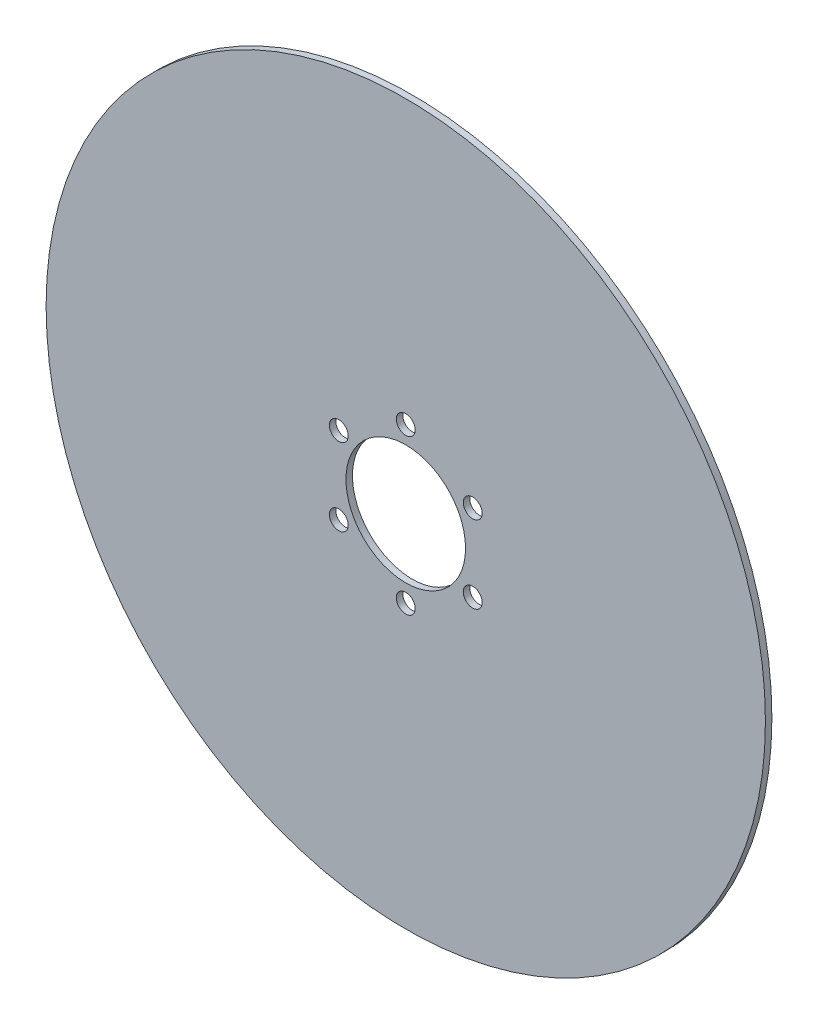
from build123d import *

# Parameters (mm, degrees)
BOSS_EXTRUDE1_DEPTH      = 0.9
BOSS_EXTRUDE1_DEPTH_BACK = 0.9
SKETCH1_R                = 100
SKETCH1_R_2              = 16.625
SKETCH1_R_3              = 2.625


with BuildPart() as part:
    # Sketch1 → Boss-Extrude1 (new, two sides: drawn at the far end of the back side and taken through both)
    with BuildSketch(Plane.XY.offset(-BOSS_EXTRUDE1_DEPTH_BACK)):
        Circle(SKETCH1_R)
        Circle(SKETCH1_R_2, mode=Mode.SUBTRACT)
        with Locations((0, 21.5)):
            Circle(SKETCH1_R_3, mode=Mode.SUBTRACT)
        with Locations((18.619546181, 10.75)):
            Circle(SKETCH1_R_3, mode=Mode.SUBTRACT)
        with Locations((18.619546181, -10.75)):
            Circle(SKETCH1_R_3, mode=Mode.SUBTRACT)
        with Locations((0, -21.5)):
            Circle(SKETCH1_R_3, mode=Mode.SUBTRACT)
        with Locations((-18.619546181, -10.75)):
            Circle(SKETCH1_R_3, mode=Mode.SUBTRACT)
        with Locations((-18.619546181, 10.75)):
            Circle(SKETCH1_R_3, mode=Mode.SUBTRACT)
    extrude(amount=BOSS_EXTRUDE1_DEPTH + BOSS_EXTRUDE1_DEPTH_BACK)


solid = part.part
